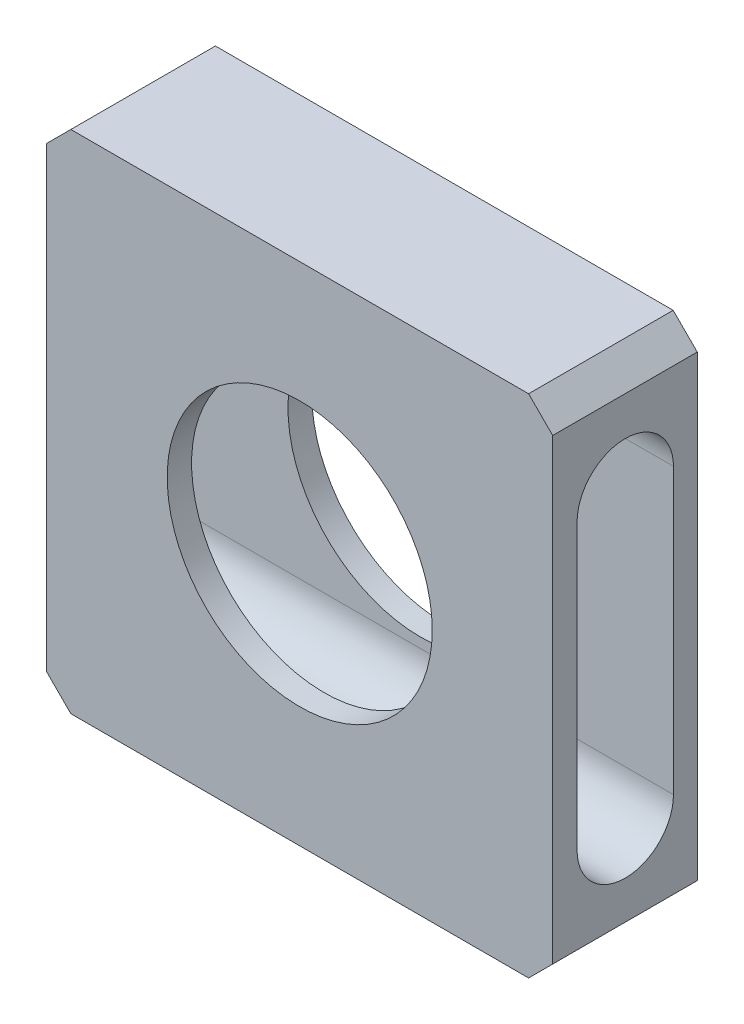
from build123d import *

# Parameters (mm, degrees)
SCHIZZO2_W                   = 42
SCHIZZO2_H                   = 42
ESTRUSIONE_ESTRUSIONE1_DEPTH = 12
SCHIZZO3_R                   = 11
TAGLIO_ESTRUSIONE1_DEPTH     = 12
TAGLIO_ESTRUSIONE2_DEPTH     = 42
SMUSSO2_SIZE                 = 2
SMUSSO3_SIZE                 = 2
SMUSSO4_SIZE                 = 2
SMUSSO5_SIZE                 = 2


with BuildPart() as part:
    # Schizzo2 → Estrusione-Estrusione1 (new body)
    with BuildSketch(Plane.XY):
        Rectangle(SCHIZZO2_W, SCHIZZO2_H)
    extrude(amount=ESTRUSIONE_ESTRUSIONE1_DEPTH)

    # Schizzo3 → Taglio-Estrusione1 (cut)
    with BuildSketch(Plane.XY):
        Circle(SCHIZZO3_R)
    extrude(amount=TAGLIO_ESTRUSIONE1_DEPTH, mode=Mode.SUBTRACT)

    # Schizzo5 → Taglio-Estrusione2 (cut)
    with BuildSketch(Plane(origin=(21, 0, 0), x_dir=(0, 0, -1), z_dir=(1, 0, 0))):
        with BuildLine():
            Line((-1.976058117, 11.770215969), (-1.976058117, -11.829784031))
            ThreePointArc((-1.976058117, -11.829784031), (-5.976058117, -15.829784031), (-9.976058117, -11.829784031))
            Line((-9.976058117, -11.829784031), (-9.976058117, 11.770215969))
            ThreePointArc((-9.976058117, 11.770215969), (-5.976058117, 15.770215969), (-1.976058117, 11.770215969))
        make_face()
    extrude(amount=-TAGLIO_ESTRUSIONE2_DEPTH, mode=Mode.SUBTRACT)

    # Smusso2
    smusso2_edges = [part.edges().sort_by_distance(p)[0] for p in [
        (-21, 21, 6),
    ]]
    chamfer(smusso2_edges, length=SMUSSO2_SIZE)

    # Smusso3
    smusso3_edges = [part.edges().sort_by_distance(p)[0] for p in [
        (21, 21, 6),
    ]]
    chamfer(smusso3_edges, length=SMUSSO3_SIZE)

    # Smusso4
    smusso4_edges = [part.edges().sort_by_distance(p)[0] for p in [
        (21, -21, 6),
    ]]
    chamfer(smusso4_edges, length=SMUSSO4_SIZE)

    # Smusso5
    smusso5_edges = [part.edges().sort_by_distance(p)[0] for p in [
        (-21, -21, 6),
    ]]
    chamfer(smusso5_edges, length=SMUSSO5_SIZE)


solid = part.part
